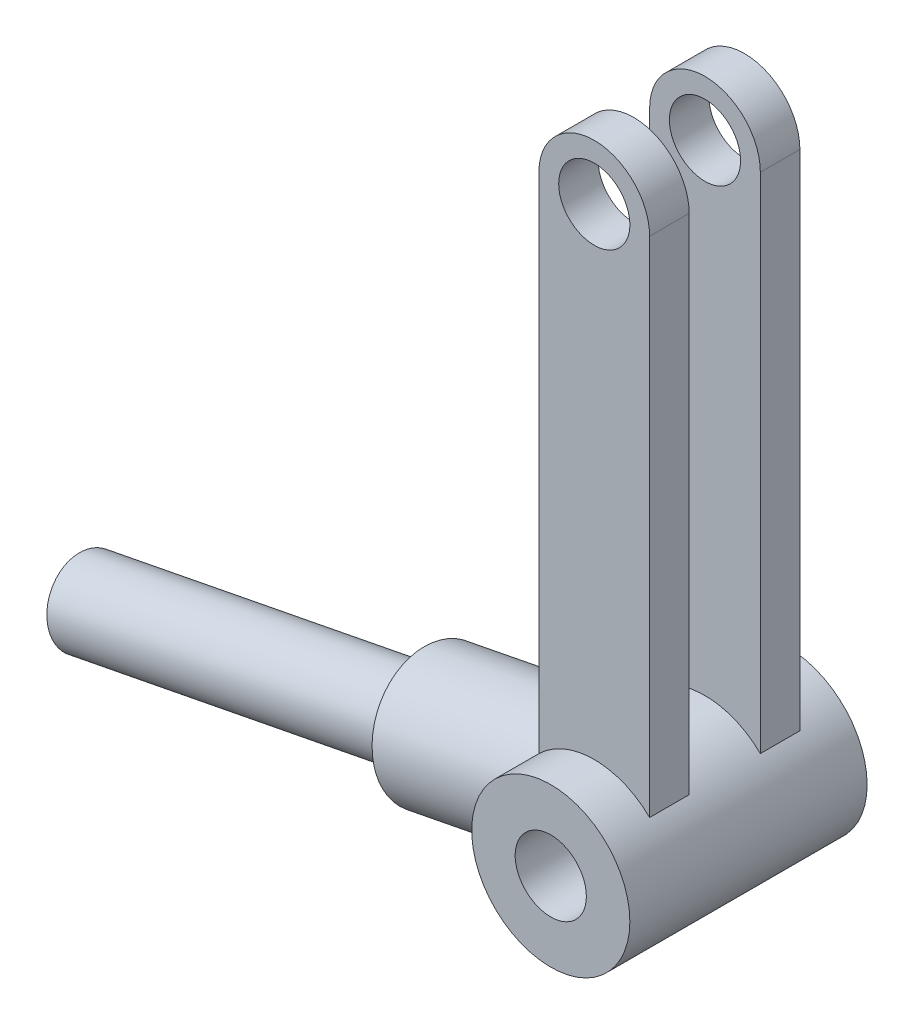
from build123d import *

# Parameters (mm, degrees)
SKETCH_1_R          = 10
EXTRUDE_1_DEPTH     = 30
SKETCH_2_R          = 4.5
CUT_EXTRUDE_1_DEPTH = 30
EXTRUDE_START       = 4.5
EXTRUDE_2_DEPTH     = 66.3
EXTRUDE_3_DEPTH     = 5
EXTRUDE_START_2     = -5
EXTRUDE_4_DEPTH     = 5
SKETCH_6_R          = 4.5
CUT_EXTRUDE_2_DEPTH = 27
SKETCH_17_R         = 5
EXTRUDE_9_DEPTH     = 45


with BuildPart() as part:
    # 草图1 → 凸台-拉伸1 (new body)
    with BuildSketch(Plane.XY):
        Circle(SKETCH_1_R)
    extrude(amount=EXTRUDE_1_DEPTH)

    # 草图2 → 切除-拉伸1 (cut)
    with BuildSketch(Plane.XY.offset(30)):
        Circle(SKETCH_2_R)
    extrude(amount=-CUT_EXTRUDE_1_DEPTH, mode=Mode.SUBTRACT)

    # 草图3 → 凸台-拉伸2 (add)
    with BuildSketch(Plane(origin=(0, 0, 0), x_dir=(1, 0, 0), z_dir=(0, 1, 0)).offset(EXTRUDE_START)):
        Polygon((0, -19.5), (7, -19.5), (7, -24.5), (-7, -24.5), (-7, -19.5), align=None)
        Polygon((0, -10.5), (7, -10.5), (7, -5.5), (-7, -5.5), (-7, -10.5), align=None)
    extrude(amount=EXTRUDE_2_DEPTH)

    # 草图4 → 凸台-拉伸3 (add)
    with BuildSketch(Plane(origin=(0, 0, 5.5), x_dir=(-1, 0, 0), z_dir=(0, 0, -1))):
        with BuildLine():
            Line((-7, 70.8), (7, 70.8))
            ThreePointArc((7, 70.8), (0, 77.8), (-7, 70.8))
        make_face()
    extrude(amount=-EXTRUDE_3_DEPTH)

    # 草图5 → 凸台-拉伸4 (add)
    with BuildSketch(Plane.XY.offset(24.5).offset(EXTRUDE_START_2)):
        with BuildLine():
            Line((-7, 70.8), (7, 70.8))
            ThreePointArc((7, 70.8), (0, 77.8), (-7, 70.8))
        make_face()
    extrude(amount=EXTRUDE_4_DEPTH)

    # 草图6 → 切除-拉伸2 (cut)
    with BuildSketch(Plane(origin=(0, 0, 5.5), x_dir=(-1, 0, 0), z_dir=(0, 0, -1))):
        with Locations((0, 70.8)):
            Circle(SKETCH_6_R)
    extrude(amount=-CUT_EXTRUDE_2_DEPTH, mode=Mode.SUBTRACT)

    # 草图15 → 旋转1 (revolve)
    with BuildSketch(Plane.XY.offset(15)):
        Polygon((-4.417472119, -0.857869498), (-5.942573449, 6.99541427), (-30.974915458, 2.134153781), (-29.449814128, -5.719129986), align=None)
    revolve(axis=Axis((-4.417472119, -0.857869498, 15), (-0.9816604709485747, -0.1906376662074486, 0)))

    # 草图17 → 凸台-拉伸9 (add)
    with BuildSketch(Plane(origin=(-29.449814128, -5.719129986, 0), x_dir=(0, 0, 1), z_dir=(-0.9816604709485748, -0.19063766620744863, 0))):
        with Locations(Location((15, 0, 0), (0, 0, 270))):
            Circle(SKETCH_17_R)
    extrude(amount=EXTRUDE_9_DEPTH)


solid = part.part
